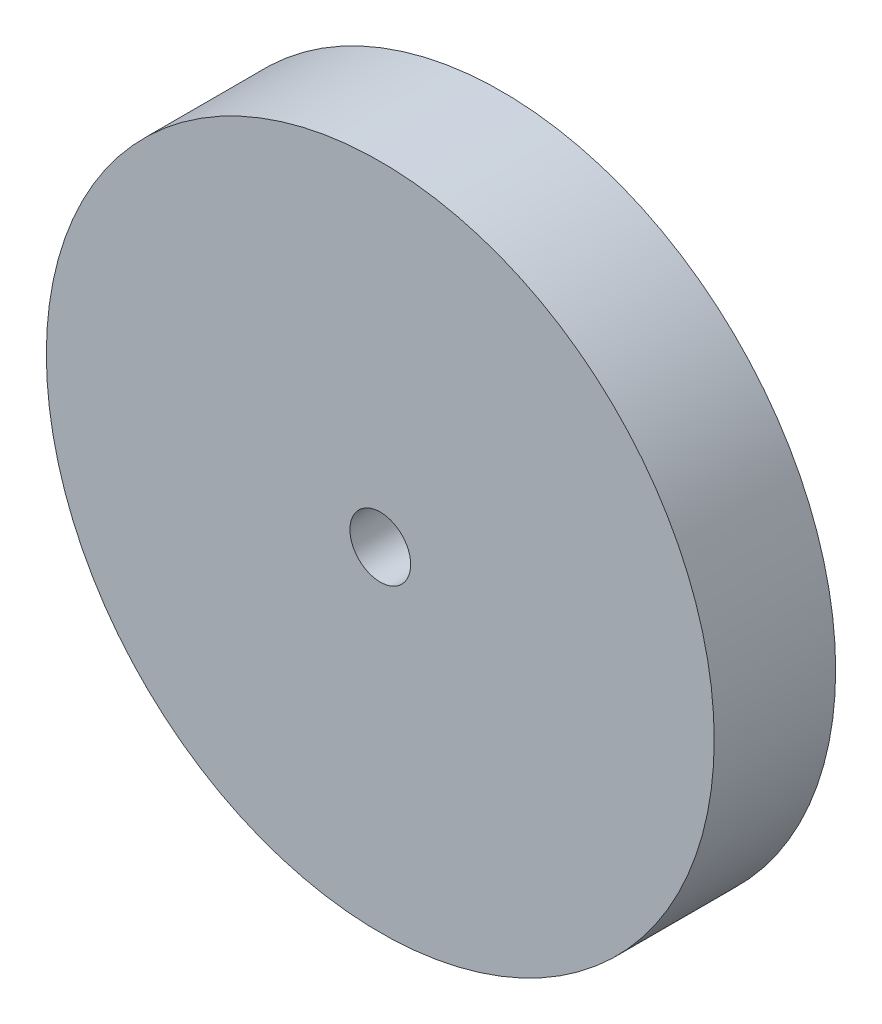
from build123d import *

# Parameters (mm, degrees)
SKETCH1_R           = 27.5
SKETCH1_R_2         = 2.5
BOSS_EXTRUDE1_DEPTH = 5


with BuildPart() as part:
    # Sketch1 → Boss-Extrude1 (new, symmetric)
    with BuildSketch(Plane.XY):
        Circle(SKETCH1_R)
        Circle(SKETCH1_R_2, mode=Mode.SUBTRACT)
    extrude(amount=BOSS_EXTRUDE1_DEPTH, both=True)


solid = part.part
